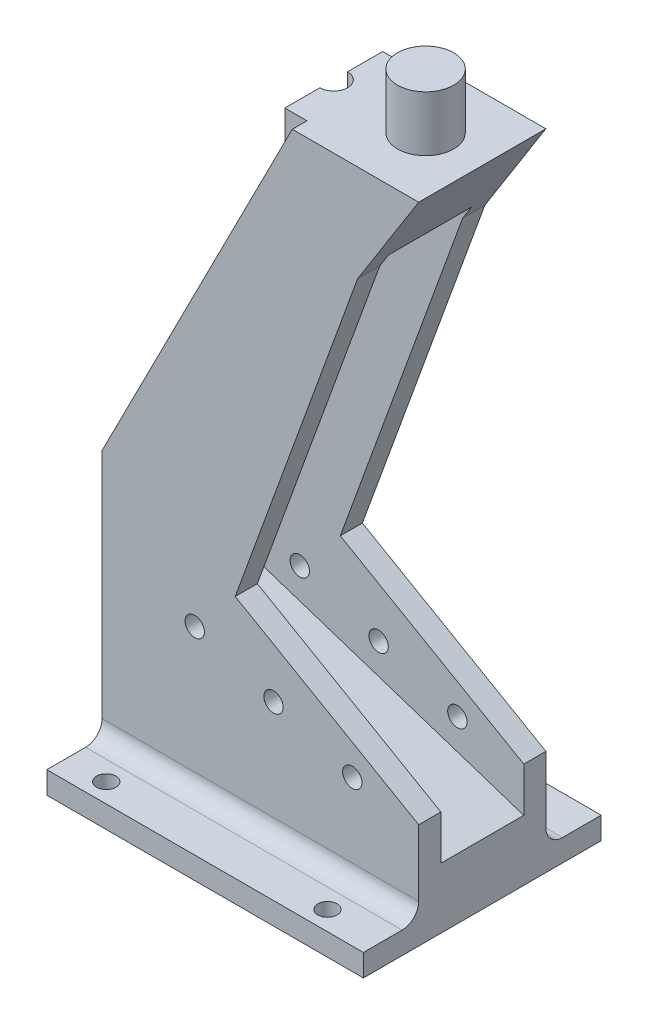
from build123d import *

# Parameters (mm, degrees)
BOSS_EXTRUDE1_DEPTH     = 11.5
SKETCH2_OUTSIDE_W       = 84.912
SKETCH2_OUTSIDE_H       = 140.162
CUT_EXTRUDE2_DEPTH      = 7.5
CUT_EXTRUDE3_DEPTH      = 129.307516771
CUT_EXTRUDE3_DEPTH_BACK = 129.307516771
SKETCH4_R               = 1.75
SKETCH5_W               = 57.250055546
SKETCH5_H               = 43
BOSS_EXTRUDE2_DEPTH     = 4
SKETCH6_R               = 1.75
CUT_EXTRUDE4_DEPTH      = 129.047135306
FILLET1_R               = 3
SKETCH7_R               = 5.08
BOSS_EXTRUDE3_DEPTH     = 10
SKETCH11_W              = 13
SKETCH11_H              = 17.7
CUT_EXTRUDE7_DEPTH      = 20
SKETCH8_W               = 4
SKETCH8_H               = 12.7
BOSS_EXTRUDE4_DEPTH     = 8.85
SKETCH9_R               = 2.5
CUT_EXTRUDE5_DEPTH      = 116.967836159
SKETCH10_R              = 1.5
CUT_EXTRUDE6_DEPTH      = 4


with BuildPart() as part:
    # Sketch1 → Boss-Extrude1 (new, symmetric)
    with BuildSketch(Plane.XY):
        Polygon((0, 45), (0, 0), (57.250055546, 0), (57.250055546, 15), (24.066011022, 34.158817039), (46.210390637, 95), (57.250055546, 112.5), (34.392967841, 112.5), align=None)
    extrude(amount=BOSS_EXTRUDE1_DEPTH, both=True)

    # Sketch2 outside → Cut-Extrude2 (cut, symmetric)
    with BuildSketch(Plane.XY):
        with Locations((28.625, 56.25)):
            Rectangle(SKETCH2_OUTSIDE_W, SKETCH2_OUTSIDE_H)
        Polygon((4, 44.039684964), (21.742887775, 78.862062909), (47.787485624, 102.92976146), (47.787485624, 97.5), (57.250055546, 112.5), (52.250055546, 112.5), (18.50330035, 81.314771653), (0, 45), (0, 0), (57.250055546, 0), (57.250055546, 6.97368477), (4, 24.475940791), align=None, mode=Mode.SUBTRACT)
        Polygon((18.50330035, 81.314771653), (52.250055546, 112.5), (34.392967841, 112.5), align=None, mode=Mode.SUBTRACT)
    extrude(amount=CUT_EXTRUDE2_DEPTH, both=True, mode=Mode.SUBTRACT)

    # Sketch4 → Cut-Extrude3 (cut, two sides: drawn at the far end of the back side and taken through both)
    with BuildSketch(Plane.XY.offset(11.5).offset(-CUT_EXTRUDE3_DEPTH_BACK)):
        with Locations((45.250055546, 16.444166257)):
            Circle(SKETCH4_R)
        with Locations((31.000040397, 21.127868666)):
            Circle(SKETCH4_R)
        with Locations((16.750025248, 25.811571075)):
            Circle(SKETCH4_R)
    extrude(amount=CUT_EXTRUDE3_DEPTH + CUT_EXTRUDE3_DEPTH_BACK, mode=Mode.SUBTRACT)

    # Sketch5 → Boss-Extrude2 (add)
    with BuildSketch(Plane.XZ):
        with Locations((28.625027773, 0)):
            Rectangle(SKETCH5_W, SKETCH5_H)
    extrude(amount=BOSS_EXTRUDE2_DEPTH)

    # Sketch6 → Cut-Extrude4 (cut, symmetric)
    with BuildSketch(Plane(origin=(0, 0, 0), x_dir=(1, 0, 0), z_dir=(0, 1, 0))):
        with Locations(Location((7.250055546, 18, 0), (0, 0, 270))):
            Circle(SKETCH6_R)
        with Locations(Location((47.250055546, 18, 0), (0, 0, 270))):
            Circle(SKETCH6_R)
    cut_extrude4 = extrude(amount=CUT_EXTRUDE4_DEPTH, both=True, mode=Mode.SUBTRACT)

    # Mirror5: Cut-Extrude4 across plane
    add(cut_extrude4.mirror(Plane.XY), mode=Mode.SUBTRACT)

    # Fillet1
    fillet1_edges = [part.edges().sort_by_distance(p)[0] for p in [
        (28.625027773, 0, 11.5),
        (28.625027773, 0, -11.5),
    ]]
    fillet(fillet1_edges, radius=FILLET1_R)

    # Sketch7 → Boss-Extrude3 (add)
    with BuildSketch(Plane(origin=(0, 112.5, 0), x_dir=(1, 0, 0), z_dir=(0, 1, 0))):
        with Locations(Location((47.000055546, 0, 0), (0, 0, 270))):
            Circle(SKETCH7_R)
    extrude(amount=BOSS_EXTRUDE3_DEPTH)

    # Sketch11 → Cut-Extrude7 (cut)
    with BuildSketch(Plane(origin=(0, 112.5, 0), x_dir=(1, 0, 0), z_dir=(0, 1, 0))):
        with Locations((27.892967841, 0)):
            Rectangle(SKETCH11_W, SKETCH11_H)
    extrude(amount=-CUT_EXTRUDE7_DEPTH, mode=Mode.SUBTRACT)

    # Sketch8 → Boss-Extrude4 (add, symmetric)
    with BuildSketch(Plane.XY):
        with Locations((32.392967841, 106.15)):
            Rectangle(SKETCH8_W, SKETCH8_H)
    extrude(amount=BOSS_EXTRUDE4_DEPTH, both=True)

    # Sketch9 → Cut-Extrude5 (cut, through all)
    with BuildSketch(Plane(origin=(47.030298994, 99.8, 0), x_dir=(-1, 0, 0), z_dir=(0, -1, 0))):
        with Locations((16.637331153, 0)):
            Circle(SKETCH9_R)
    extrude(amount=-CUT_EXTRUDE5_DEPTH, mode=Mode.SUBTRACT)

    # Sketch10 → Cut-Extrude6 (cut)
    with BuildSketch(Plane(origin=(30.392967841, -1.431684556, 0), x_dir=(0, 0, 1), z_dir=(-1, 0, 0))):
        with Locations(Location((-5.675, 107.581684556, 0), (0, 0, 270))):
            Circle(SKETCH10_R)
        with Locations(Location((5.675, 107.581684556, 0), (0, 0, 270))):
            Circle(SKETCH10_R)
    extrude(amount=-CUT_EXTRUDE6_DEPTH, mode=Mode.SUBTRACT)


solid = part.part
